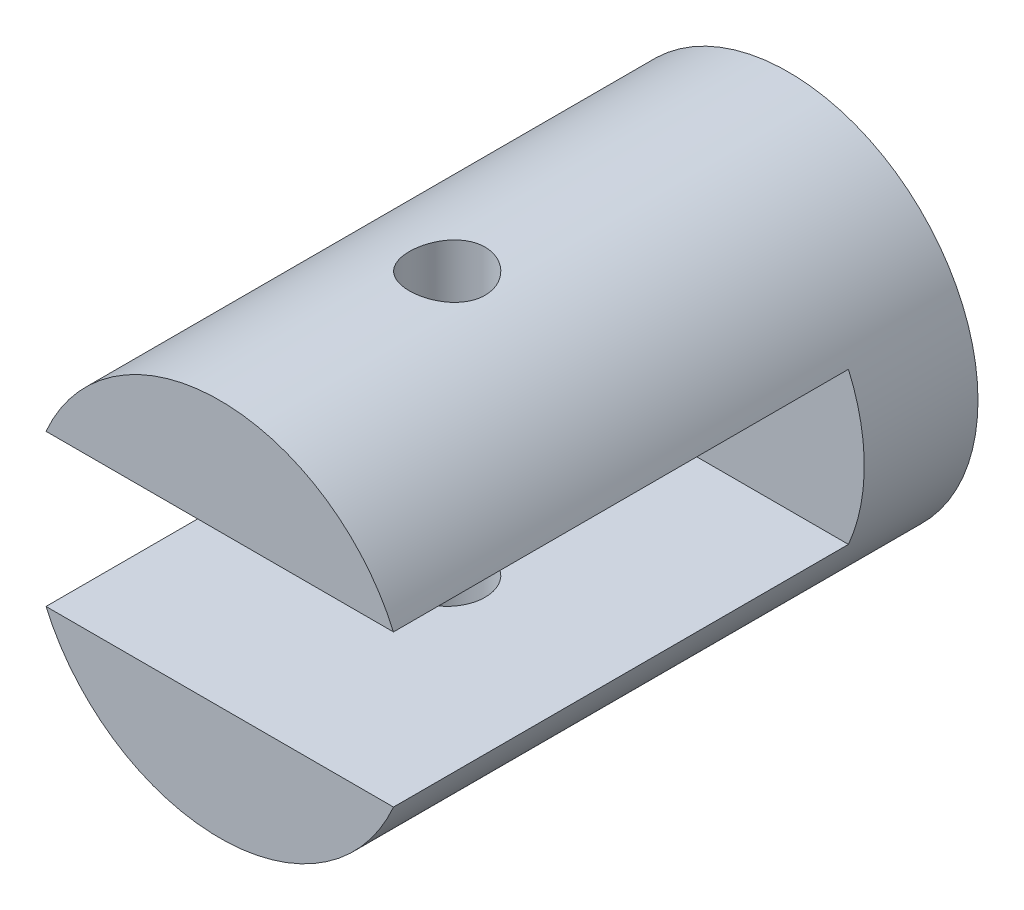
from build123d import *

# Parameters (mm, degrees)
SKETCH2_R            = 50
BOSS_EXTRUDE1_DEPTH  = 150
SKETCH3_OUTSIDE_W    = 143.232
SKETCH3_OUTSIDE_H    = 143.232
CUT_EXTRUDE1_DEPTH   = 120
CUT_SWEEP1_PROFILE_R = 10


with BuildPart() as part:
    # Sketch2 → Boss-Extrude1 (new body)
    with BuildSketch(Plane.XY):
        Circle(SKETCH2_R)
    extrude(amount=BOSS_EXTRUDE1_DEPTH)

    # Sketch3 outside → Cut-Extrude1 (cut)
    with BuildSketch(Plane.XY.offset(150)):
        Rectangle(SKETCH3_OUTSIDE_W, SKETCH3_OUTSIDE_H)
        with BuildLine():
            Line((-45.82575695, 20), (45.82575695, 20))
            ThreePointArc((45.82575695, 20), (0, 50), (-45.82575695, 20))
        make_face(mode=Mode.SUBTRACT)
        with BuildLine():
            Line((45.82575695, -20), (-45.82575695, -20))
            ThreePointArc((-45.82575695, -20), (0, -50), (45.82575695, -20))
        make_face(mode=Mode.SUBTRACT)
    extrude(amount=-CUT_EXTRUDE1_DEPTH, mode=Mode.SUBTRACT)

    # Cut-Sweep1: sweep along a path in Sketch5
    with BuildLine(Plane.XY.offset(90)) as cut_sweep1_path:
        Line((0, 50), (0, -50))
    # Cut-Sweep1 profile (on start of the path) → Cut-Sweep1 (sweep, cut)
    with BuildSketch(Plane(origin=(0, 50, 90), x_dir=(-1, 0, 0), z_dir=(0, -1, 0))):
        Circle(CUT_SWEEP1_PROFILE_R)
    sweep(path=cut_sweep1_path.line, mode=Mode.SUBTRACT)


solid = part.part
